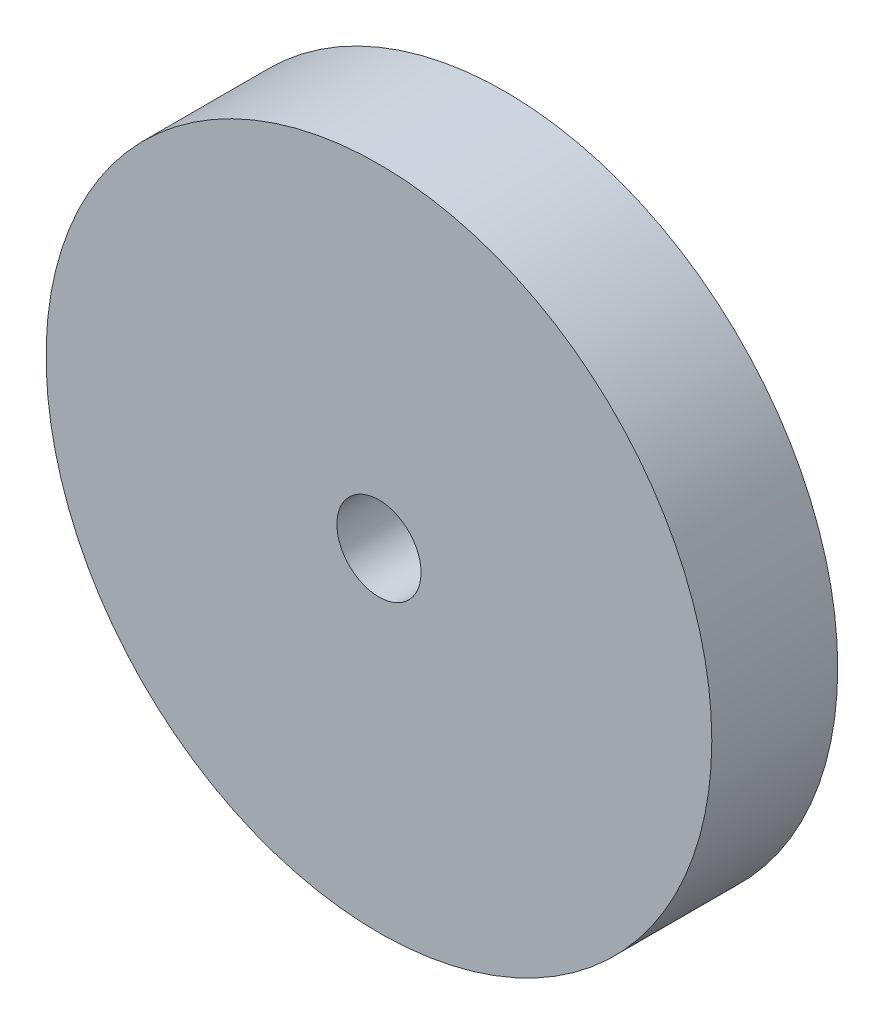
from build123d import *

# Parameters (mm, degrees)
SKETCH1_R           = 14.7703125
SKETCH1_R_2         = 1.8669
BOSS_EXTRUDE1_DEPTH = 5.588


with BuildPart() as part:
    # Sketch1 → Boss-Extrude1 (new body)
    with BuildSketch(Plane.XY):
        Circle(SKETCH1_R)
        Circle(SKETCH1_R_2, mode=Mode.SUBTRACT)
    extrude(amount=BOSS_EXTRUDE1_DEPTH)


solid = part.part
